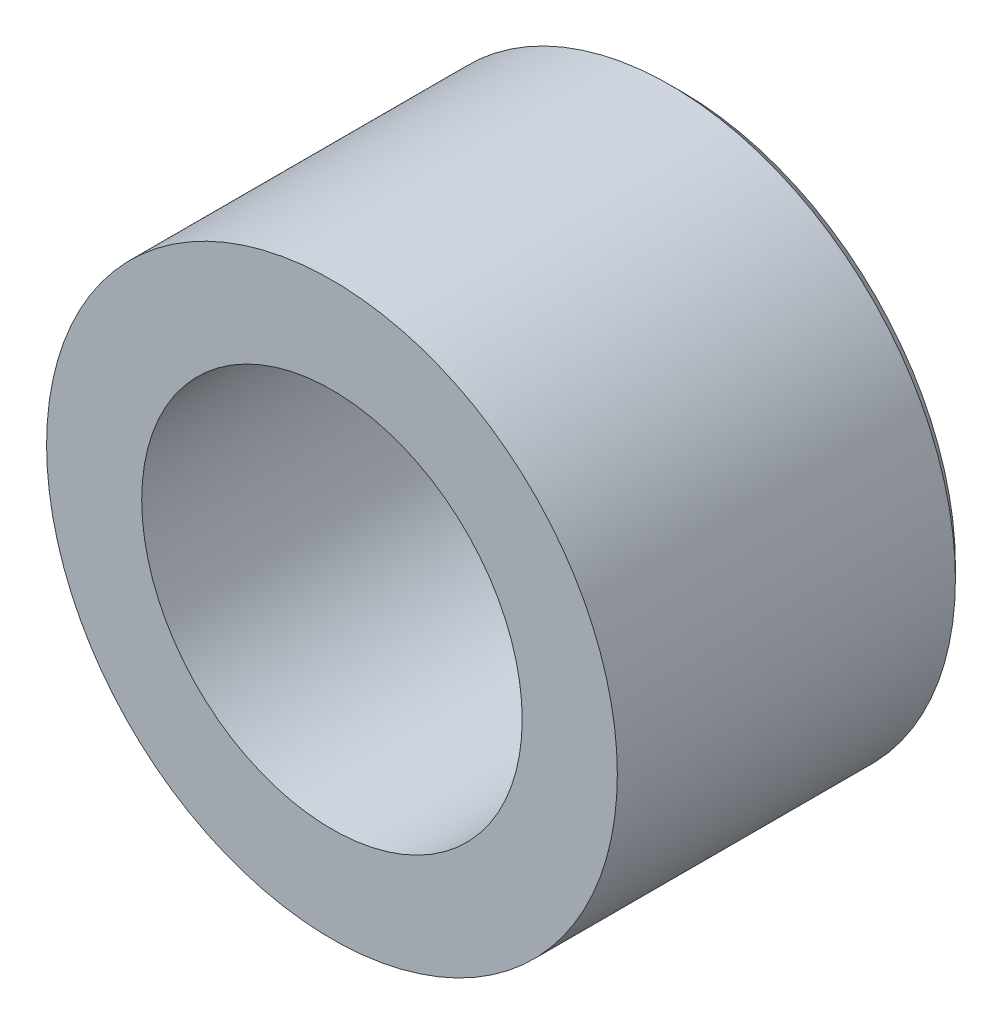
from build123d import *

# Parameters (mm, degrees)
SKETCH1_R           = 4.7625
SKETCH1_R_2         = 3.175
BOSS_EXTRUDE1_DEPTH = 5.842
CHAMFER1_SIZE       = 0.4
CHAMFER2_SIZE       = 0.2


with BuildPart() as part:
    # Sketch1 → Boss-Extrude1 (new body)
    with BuildSketch(Plane.XY):
        Circle(SKETCH1_R)
        Circle(SKETCH1_R_2, mode=Mode.SUBTRACT)
    extrude(amount=BOSS_EXTRUDE1_DEPTH)

    # Chamfer1
    chamfer1_edges = [part.edges().sort_by_distance(p)[0] for p in [
        (-3.175, 0, 0),
    ]]
    chamfer(chamfer1_edges, length=CHAMFER1_SIZE)

    # Chamfer2
    chamfer2_edges = [part.edges().sort_by_distance(p)[0] for p in [
        (-4.7625, 0, 0),
    ]]
    chamfer(chamfer2_edges, length=CHAMFER2_SIZE)


solid = part.part
